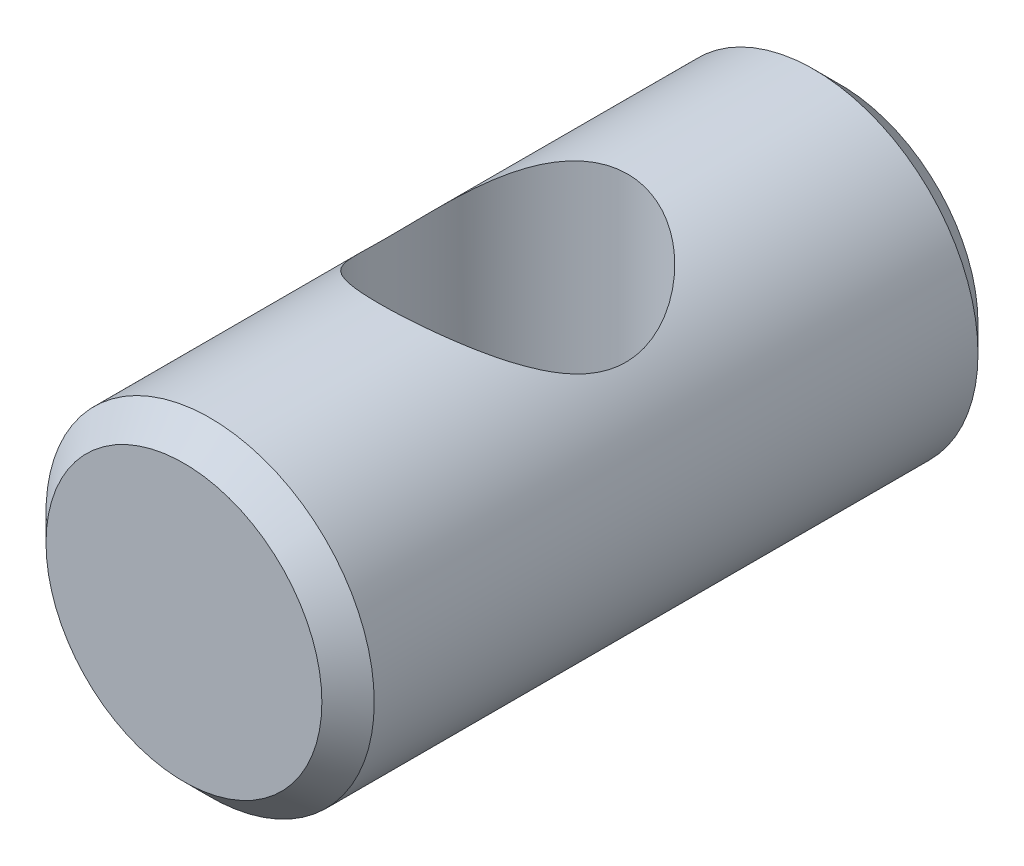
from build123d import *

# Parameters (mm, degrees)
SKETCH1_R               = 4.765
BOSS_EXTRUDE1_DEPTH     = 9.525
CUT_EXTRUDE1_DEPTH      = 12.667736499
CUT_EXTRUDE1_DEPTH_BACK = 12.667736499
SKETCH2_R               = 3.43
CHAMFER1_SIZE           = 0.76


with BuildPart() as part:
    # Sketch1 → Boss-Extrude1 (new, symmetric)
    with BuildSketch(Plane.XY):
        with Locations(Location((0, 0, 0), (0, 0, 180))):
            Circle(SKETCH1_R)
    extrude(amount=BOSS_EXTRUDE1_DEPTH, both=True)

    # Sketch2 → Cut-Extrude1 (cut, two sides: drawn at the far end of the back side and taken through both)
    with BuildSketch(Plane(origin=(0, 0, 0), x_dir=(1, 0, 0), z_dir=(0, 1, 0)).offset(-CUT_EXTRUDE1_DEPTH_BACK)):
        with Locations(Location((-0.125, 0, 0), (0, 0, 270))):
            Circle(SKETCH2_R)
    extrude(amount=CUT_EXTRUDE1_DEPTH + CUT_EXTRUDE1_DEPTH_BACK, mode=Mode.SUBTRACT)

    # Chamfer1
    chamfer1_edges = [part.edges().sort_by_distance(p)[0] for p in [
        (4.765, 0, -9.525),
        (4.765, 0, 9.525),
    ]]
    chamfer(chamfer1_edges, length=CHAMFER1_SIZE)


solid = part.part
